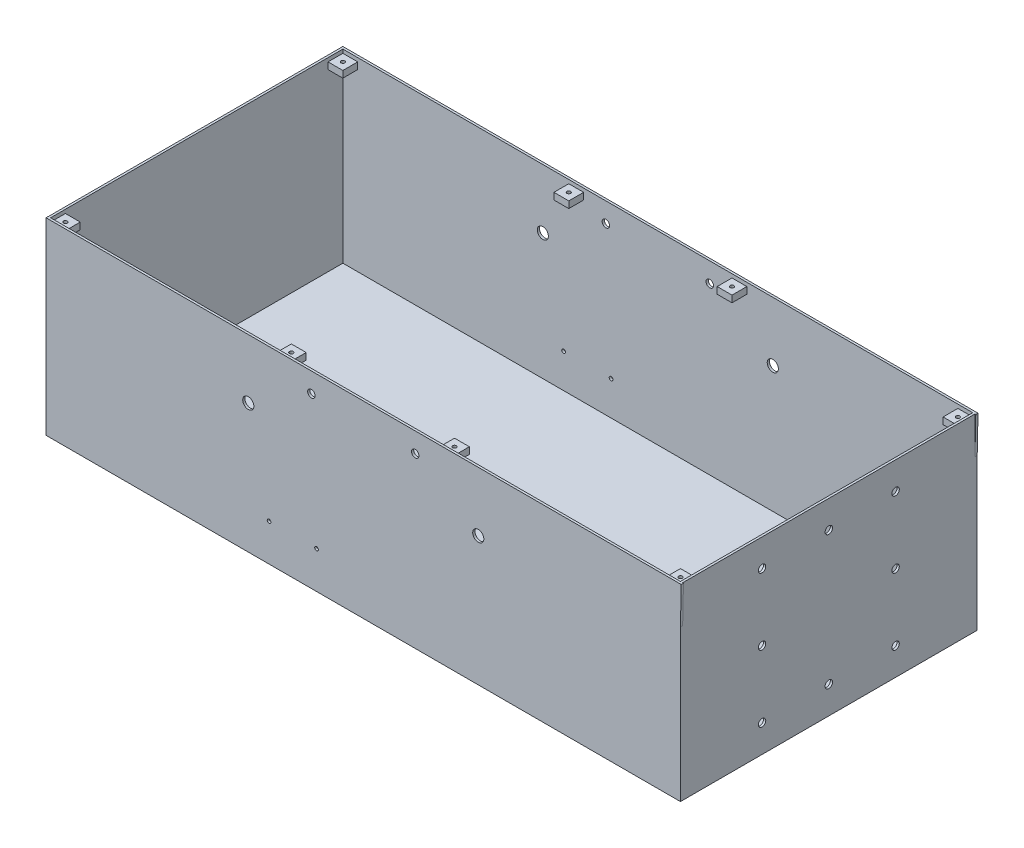
from build123d import *

# Parameters (mm, degrees)
SKETCH1_W            = 855
SKETCH1_H            = 400
BOSS_EXTRUDE1_DEPTH  = 4
SKETCH3_W            = 3
SKETCH3_H            = 394
BOSS_EXTRUDE2_DEPTH  = 200
BOSS_EXTRUDE3_DEPTH  = 3
BOSS_EXTRUDE4_START  = -3
BOSS_EXTRUDE4_DEPTH  = 3
SKETCH10_R           = 5
CUT_EXTRUDE4_DEPTH   = 639.178854241
SKETCH11_R           = 2.5
CUT_EXTRUDE5_DEPTH   = 639.178854241
BOSS_EXTRUDE7_DEPTH  = 3
BOSS_EXTRUDE10_START = -3
BOSS_EXTRUDE10_DEPTH = 3
SKETCH33_W           = 3
SKETCH33_H           = 394
BOSS_EXTRUDE14_DEPTH = 50
SKETCH34_W           = 3
SKETCH34_H           = 394
BOSS_EXTRUDE15_DEPTH = 50
SKETCH36_W           = 20
SKETCH36_H           = 20
BOSS_EXTRUDE16_DEPTH = 9
SKETCH40_R           = 2.5
CUT_EXTRUDE6_DEPTH   = 9
SKETCH44_W           = 20
SKETCH44_H           = 20
BOSS_EXTRUDE18_DEPTH = 9
SKETCH45_R           = 2.5
CUT_EXTRUDE7_DEPTH   = 9
SKETCH46_W           = 20
SKETCH46_H           = 20
BOSS_EXTRUDE19_DEPTH = 9
SKETCH47_R           = 2.5
CUT_EXTRUDE8_DEPTH   = 9
SKETCH48_W           = 20
SKETCH48_H           = 20
BOSS_EXTRUDE20_DEPTH = 9
SKETCH49_R           = 2.5
CUT_EXTRUDE9_DEPTH   = 9
SKETCH50_W           = 20
SKETCH50_H           = 20
BOSS_EXTRUDE21_DEPTH = 9
SKETCH51_R           = 2.5
CUT_EXTRUDE10_DEPTH  = 9
SKETCH52_W           = 20
SKETCH52_H           = 20
BOSS_EXTRUDE22_DEPTH = 9
SKETCH53_R           = 2.5
CUT_EXTRUDE11_DEPTH  = 9
SKETCH58_W           = 20
SKETCH58_H           = 20
BOSS_EXTRUDE25_DEPTH = 9
SKETCH61_R           = 2.5
CUT_EXTRUDE13_DEPTH  = 9
SKETCH62_W           = 20
SKETCH62_H           = 20
BOSS_EXTRUDE26_DEPTH = 9
SKETCH63_R           = 2.5
CUT_EXTRUDE14_DEPTH  = 9
SKETCH64_R           = 7.5
CUT_EXTRUDE15_DEPTH  = 639.906527631
SKETCH65_R           = 5
CUT_EXTRUDE16_DEPTH  = 3


with BuildPart() as part:
    # Sketch1 → Boss-Extrude1 (new body)
    with BuildSketch(Plane(origin=(0, 0, 0), x_dir=(1, 0, 0), z_dir=(0, 1, 0))):
        Rectangle(SKETCH1_W, SKETCH1_H)
    extrude(amount=BOSS_EXTRUDE1_DEPTH)

    # Sketch3 → Boss-Extrude2 (add)
    with BuildSketch(Plane(origin=(0, 4, 0), x_dir=(1, 0, 0), z_dir=(0, 1, 0))):
        Polygon((-424.5, 200), (-424.5, 197), (424.5, 197), (427.5, 197), (427.5, 200), align=None)
        with Locations((426, 0)):
            Rectangle(SKETCH3_W, SKETCH3_H)
        Polygon((-427.5, -197), (-427.5, -200), (427.5, -200), (427.5, -197), (424.5, -197), (-424.5, -197), align=None)
        Polygon((-427.5, 200), (-427.5, -197), (-424.5, -197), (-424.5, 197), (-424.5, 200), align=None)
    extrude(amount=BOSS_EXTRUDE2_DEPTH)

    # Sketch4 → Boss-Extrude3 (add)
    with BuildSketch(Plane.XY.offset(200)):
        with BuildLine():
            ThreePointArc((427.5, 204), (215.207022423, 241.457541713), (0, 254))
            Line((0, 254), (0, 204))
            Line((0, 204), (427.5, 204))
        make_face()
        with BuildLine():
            Line((0, 204), (0, 254))
            ThreePointArc((0, 254), (-215.207022423, 241.457541713), (-427.5, 204))
            Line((-427.5, 204), (0, 204))
        make_face()
        with BuildLine():
            ThreePointArc((427.5, 204), (215.207022423, 241.457541713), (0, 254))
            Line((0, 254), (0, 204))
            Line((0, 204), (427.5, 204))
        make_face()
        with BuildLine():
            Line((0, 204), (0, 254))
            ThreePointArc((0, 254), (-215.207022423, 241.457541713), (-427.5, 204))
            Line((-427.5, 204), (0, 204))
        make_face()
    extrude(amount=-BOSS_EXTRUDE3_DEPTH)

    # Sketch6 → Boss-Extrude4 (add)
    with BuildSketch(Plane(origin=(0, 0, -200), x_dir=(-1, 0, 0), z_dir=(0, 0, -1)).offset(BOSS_EXTRUDE4_START)):
        with BuildLine():
            ThreePointArc((427.5, 204), (215.207022423, 241.457541713), (0, 254))
            Line((0, 254), (0, 204))
            Line((0, 204), (427.5, 204))
        make_face()
        with BuildLine():
            Line((0, 204), (0, 254))
            ThreePointArc((0, 254), (-215.207022423, 241.457541713), (-427.5, 204))
            Line((-427.5, 204), (0, 204))
        make_face()
        with BuildLine():
            ThreePointArc((427.5, 204), (215.207022423, 241.457541713), (0, 254))
            Line((0, 254), (0, 204))
            Line((0, 204), (427.5, 204))
        make_face()
        with BuildLine():
            Line((0, 204), (0, 254))
            ThreePointArc((0, 254), (-215.207022423, 241.457541713), (-427.5, 204))
            Line((-427.5, 204), (0, 204))
        make_face()
    extrude(amount=BOSS_EXTRUDE4_DEPTH)

    # Sketch10 → Cut-Extrude4 (cut, through all)
    with BuildSketch(Plane.XY.offset(200)):
        with Locations((70, 227.5)):
            Circle(SKETCH10_R)
        with Locations((-70, 227.5)):
            Circle(SKETCH10_R)
    extrude(amount=-CUT_EXTRUDE4_DEPTH, mode=Mode.SUBTRACT)

    # Sketch11 → Cut-Extrude5 (cut, through all)
    with BuildSketch(Plane.XY.offset(200)):
        with Locations((-63, 50)):
            Circle(SKETCH11_R)
        with Locations((-127, 50)):
            Circle(SKETCH11_R)
    extrude(amount=-CUT_EXTRUDE5_DEPTH, mode=Mode.SUBTRACT)

    # Sketch12 → Boss-Extrude7 (add)
    with BuildSketch(Plane.XY.offset(200)):
        with BuildLine():
            Line((428.585523611, 254), (0, 254))
            ThreePointArc((0, 254), (215.207022423, 241.457541713), (427.5, 204))
            Line((427.5, 204), (428.585523611, 254))
        make_face()
        with BuildLine():
            ThreePointArc((-427.5, 204), (-215.207022423, 241.457541713), (0, 254))
            Line((0, 254), (-427.66164317, 254))
            Line((-427.66164317, 254), (-427.5, 204))
        make_face()
    extrude(amount=-BOSS_EXTRUDE7_DEPTH)

    # Sketch23 → Boss-Extrude10 (add)
    # profile 1 of 2: a face of its own
    with BuildSketch(Plane(origin=(0, 0, -200), x_dir=(-1, 0, 0), z_dir=(0, 0, -1)).offset(BOSS_EXTRUDE10_START)):
        with BuildLine():
            Line((-428.585523611, 254), (-427.5, 204))
            add(Edge.make_bspline(
                [(-427.5, 204), (-213.75, 254), (0, 254)],
                knots=[0, 0, 0, 0.5, 0.5, 0.5], degree=2))
            Line((0, 254), (-428.585523611, 254))
        make_face()
    # profile 2 of 2: a face of its own
    with BuildSketch(Plane(origin=(0, 0, -200), x_dir=(-1, 0, 0), z_dir=(0, 0, -1)).offset(BOSS_EXTRUDE10_START)):
        with BuildLine():
            Line((427.66164317, 254), (0, 254))
            add(Edge.make_bspline(
                [(0, 254), (213.75, 254), (427.5, 204)],
                knots=[0.5, 0.5, 0.5, 1, 1, 1], degree=2))
            Line((427.5, 204), (427.66164317, 254))
        make_face()
        with BuildLine():
            ThreePointArc((0, 254), (215.207022423, 241.457541713), (427.5, 204))
            add(Edge.make_bspline(
                [(0, 254), (213.75, 254), (427.5, 204)],
                knots=[0.5, 0.5, 0.5, 1, 1, 1], degree=2))
        make_face(mode=Mode.SUBTRACT)
    extrude(amount=BOSS_EXTRUDE10_DEPTH)

    # Sketch33 → Boss-Extrude14 (add)
    with BuildSketch(Plane(origin=(0, 204, 0), x_dir=(1, 0, 0), z_dir=(0, 1, 0))):
        with Locations((-426, 0)):
            Rectangle(SKETCH33_W, SKETCH33_H)
    extrude(amount=BOSS_EXTRUDE14_DEPTH)

    # Sketch34 → Boss-Extrude15 (add)
    with BuildSketch(Plane(origin=(0, 204, 0), x_dir=(1, 0, 0), z_dir=(0, 1, 0))):
        with Locations((426, 0)):
            Rectangle(SKETCH34_W, SKETCH34_H)
    extrude(amount=BOSS_EXTRUDE15_DEPTH)

    # Sketch36 → Boss-Extrude16 (add)
    with BuildSketch(Plane(origin=(0, 240, 0), x_dir=(1, 0, 0), z_dir=(0, 1, 0))):
        with Locations((-414.5, 187)):
            Rectangle(SKETCH36_W, SKETCH36_H)
    extrude(amount=BOSS_EXTRUDE16_DEPTH)

    # Sketch40 → Cut-Extrude6 (cut)
    with BuildSketch(Plane(origin=(0, 254, 0), x_dir=(1, 0, 0), z_dir=(0, 1, 0))):
        with Locations(Location((-414.5, 187, 0), (0, 0, 270))):
            Circle(SKETCH40_R)
    extrude(amount=-CUT_EXTRUDE6_DEPTH, mode=Mode.SUBTRACT)

    # Sketch44 → Boss-Extrude18 (add)
    with BuildSketch(Plane(origin=(0, 240, 0), x_dir=(1, 0, 0), z_dir=(0, 1, 0))):
        with Locations((-414.5, -187)):
            Rectangle(SKETCH44_W, SKETCH44_H)
    extrude(amount=BOSS_EXTRUDE18_DEPTH)

    # Sketch45 → Cut-Extrude7 (cut)
    with BuildSketch(Plane(origin=(0, 254, 0), x_dir=(1, 0, 0), z_dir=(0, 1, 0))):
        with Locations(Location((-414.5, -187, 0), (0, 0, 270))):
            Circle(SKETCH45_R)
    extrude(amount=-CUT_EXTRUDE7_DEPTH, mode=Mode.SUBTRACT)

    # Sketch46 → Boss-Extrude19 (add)
    with BuildSketch(Plane(origin=(0, 240, 0), x_dir=(1, 0, 0), z_dir=(0, 1, 0))):
        with Locations((414.5, 187)):
            Rectangle(SKETCH46_W, SKETCH46_H)
    extrude(amount=BOSS_EXTRUDE19_DEPTH)

    # Sketch47 → Cut-Extrude8 (cut)
    with BuildSketch(Plane(origin=(0, 254, 0), x_dir=(1, 0, 0), z_dir=(0, 1, 0))):
        with Locations(Location((414.5, 187, 0), (0, 0, 270))):
            Circle(SKETCH47_R)
    extrude(amount=-CUT_EXTRUDE8_DEPTH, mode=Mode.SUBTRACT)

    # Sketch48 → Boss-Extrude20 (add)
    with BuildSketch(Plane(origin=(0, 240, 0), x_dir=(1, 0, 0), z_dir=(0, 1, 0))):
        with Locations((414.5, -187)):
            Rectangle(SKETCH48_W, SKETCH48_H)
    extrude(amount=BOSS_EXTRUDE20_DEPTH)

    # Sketch49 → Cut-Extrude9 (cut)
    with BuildSketch(Plane(origin=(0, 254, 0), x_dir=(1, 0, 0), z_dir=(0, 1, 0))):
        with Locations(Location((414.5, -187, 0), (0, 0, 270))):
            Circle(SKETCH49_R)
    extrude(amount=-CUT_EXTRUDE9_DEPTH, mode=Mode.SUBTRACT)

    # Sketch50 → Boss-Extrude21 (add)
    with BuildSketch(Plane(origin=(0, 240, 0), x_dir=(1, 0, 0), z_dir=(0, 1, 0))):
        with Locations((110, 187)):
            Rectangle(SKETCH50_W, SKETCH50_H)
    extrude(amount=BOSS_EXTRUDE21_DEPTH)

    # Sketch51 → Cut-Extrude10 (cut)
    with BuildSketch(Plane(origin=(0, 254, 0), x_dir=(1, 0, 0), z_dir=(0, 1, 0))):
        with Locations(Location((110, 187, 0), (0, 0, 270))):
            Circle(SKETCH51_R)
    extrude(amount=-CUT_EXTRUDE10_DEPTH, mode=Mode.SUBTRACT)

    # Sketch52 → Boss-Extrude22 (add)
    with BuildSketch(Plane(origin=(0, 240, 0), x_dir=(1, 0, 0), z_dir=(0, 1, 0))):
        with Locations((110, -187)):
            Rectangle(SKETCH52_W, SKETCH52_H)
    extrude(amount=BOSS_EXTRUDE22_DEPTH)

    # Sketch53 → Cut-Extrude11 (cut)
    with BuildSketch(Plane(origin=(0, 254, 0), x_dir=(1, 0, 0), z_dir=(0, 1, 0))):
        with Locations(Location((110, -187, 0), (0, 0, 270))):
            Circle(SKETCH53_R)
    extrude(amount=-CUT_EXTRUDE11_DEPTH, mode=Mode.SUBTRACT)

    # Sketch58 → Boss-Extrude25 (add)
    with BuildSketch(Plane(origin=(0, 240, 0), x_dir=(1, 0, 0), z_dir=(0, 1, 0))):
        with Locations((-110, 187)):
            Rectangle(SKETCH58_W, SKETCH58_H)
    extrude(amount=BOSS_EXTRUDE25_DEPTH)

    # Sketch61 → Cut-Extrude13 (cut)
    with BuildSketch(Plane(origin=(0, 254, 0), x_dir=(1, 0, 0), z_dir=(0, 1, 0))):
        with Locations(Location((-110, 187, 0), (0, 0, 270))):
            Circle(SKETCH61_R)
    extrude(amount=-CUT_EXTRUDE13_DEPTH, mode=Mode.SUBTRACT)

    # Sketch62 → Boss-Extrude26 (add)
    with BuildSketch(Plane(origin=(0, 240, 0), x_dir=(1, 0, 0), z_dir=(0, 1, 0))):
        with Locations((-110, -187)):
            Rectangle(SKETCH62_W, SKETCH62_H)
    extrude(amount=BOSS_EXTRUDE26_DEPTH)

    # Sketch63 → Cut-Extrude14 (cut)
    with BuildSketch(Plane(origin=(0, 254, 0), x_dir=(1, 0, 0), z_dir=(0, 1, 0))):
        with Locations(Location((-110, -187, 0), (0, 0, 270))):
            Circle(SKETCH63_R)
    extrude(amount=-CUT_EXTRUDE14_DEPTH, mode=Mode.SUBTRACT)

    # Sketch64 → Cut-Extrude15 (cut, through all)
    with BuildSketch(Plane.XY.offset(200)):
        with Locations((155, 174)):
            Circle(SKETCH64_R)
        with Locations((-155, 174)):
            Circle(SKETCH64_R)
    extrude(amount=-CUT_EXTRUDE15_DEPTH, mode=Mode.SUBTRACT)

    # Sketch65 → Cut-Extrude16 (cut)
    with BuildSketch(Plane(origin=(427.5, 0, 0), x_dir=(0, 0, -1), z_dir=(1, 0, 0))):
        with Locations((90, 216.999992336)):
            Circle(SKETCH65_R)
        with Locations((0, 216.999996168)):
            Circle(SKETCH65_R)
        with Locations((-90, 217)):
            Circle(SKETCH65_R)
        with Locations((-90, 127)):
            Circle(SKETCH65_R)
        with Locations((90, 127)):
            Circle(SKETCH65_R)
        with Locations((90, 36.999996168)):
            Circle(SKETCH65_R)
        with Locations((0, 36.999996168)):
            Circle(SKETCH65_R)
        with Locations((-90, 37)):
            Circle(SKETCH65_R)
    extrude(amount=-CUT_EXTRUDE16_DEPTH, mode=Mode.SUBTRACT)


solid = part.part
